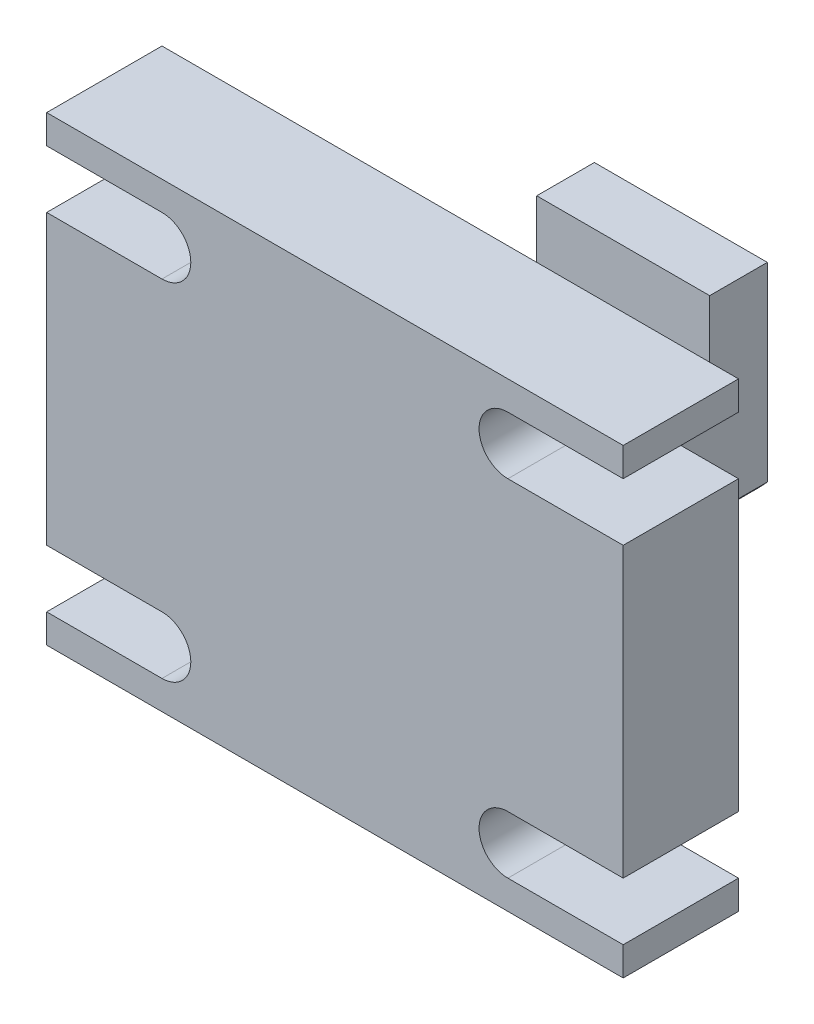
from build123d import *

# Parameters (mm, degrees)
EXTRUDE_1_DEPTH = 20
EXTRUDE_2_DEPTH = 10
SKETCH_3_R      = 5
EXTRUDE_3_DEPTH = 10


with BuildPart() as part:
    # 草圖1 → 填料-伸長1 (new body)
    with BuildSketch(Plane.XY):
        with BuildLine():
            Line((50, 40), (-50, 40))
            Line((-50, 40), (-50, 35))
            Line((-50, 35), (-30, 35))
            ThreePointArc((-30, 35), (-25, 30), (-30, 25))
            Line((-30, 25), (-50, 25))
            Line((-50, 25), (-50, -25))
            Line((-50, -25), (-30, -25))
            ThreePointArc((-30, -25), (-25, -30), (-30, -35))
            Line((-30, -35), (-50, -35))
            Line((-50, -35), (-50, -40))
            Line((-50, -40), (50, -40))
            Line((50, -40), (50, -35))
            Line((50, -35), (30, -35))
            ThreePointArc((30, -35), (25, -30), (30, -25))
            Line((30, -25), (50, -25))
            Line((50, -25), (50, 25))
            Line((50, 25), (30, 25))
            ThreePointArc((30, 25), (25, 30), (30, 35))
            Line((30, 35), (50, 35))
            Line((50, 35), (50, 40))
        make_face()
    extrude(amount=EXTRUDE_1_DEPTH)

    # 草圖2 → 填料-伸長2 (add)
    with BuildSketch(Plane(origin=(0, -5, 0), x_dir=(-1, 0, 0), z_dir=(0, -1, 0))):
        with BuildLine():
            ThreePointArc((15, 10), (17.928932188, 2.928932188), (25, 0))
            Line((25, 0), (-25, 0))
            ThreePointArc((-25, 0), (-17.928932188, 2.928932188), (-15, 10))
            Line((-15, 10), (-15, 30))
            Line((-15, 30), (15, 30))
            Line((15, 30), (15, 10))
        make_face()
    extrude(amount=-EXTRUDE_2_DEPTH)

    # 草圖3 → 填料-伸長3 (add)
    with BuildSketch(Plane(origin=(0, 0, -30), x_dir=(-1, 0, 0), z_dir=(0, 0, -1))):
        with BuildLine():
            Line((-15, 20), (15, 20))
            Line((15, 20), (15, -13))
            ThreePointArc((15, -13), (0, -20), (-15, -13))
            Line((-15, -13), (-15, 20))
        make_face()
        with Locations((0, -13)):
            Circle(SKETCH_3_R, mode=Mode.SUBTRACT)
    extrude(amount=EXTRUDE_3_DEPTH)


solid = part.part
